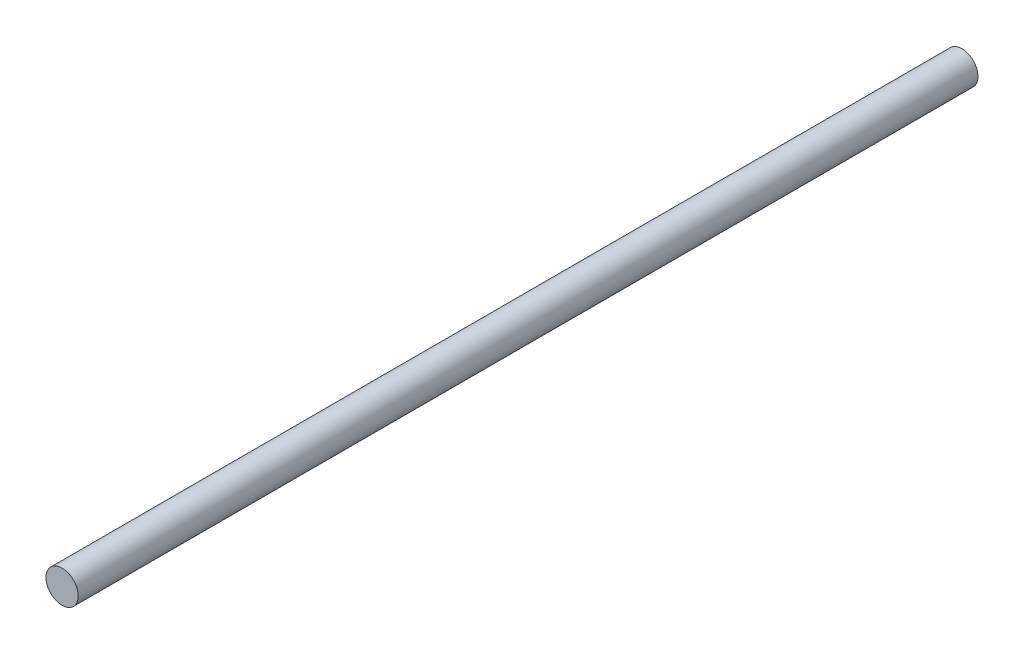
from build123d import *

# Parameters (mm, degrees)
SKETCH1_R           = 4
BOSS_EXTRUDE1_DEPTH = 223.5


with BuildPart() as part:
    # Sketch1 → Boss-Extrude1 (new body)
    with BuildSketch(Plane.XY):
        Circle(SKETCH1_R)
    extrude(amount=BOSS_EXTRUDE1_DEPTH)


solid = part.part
